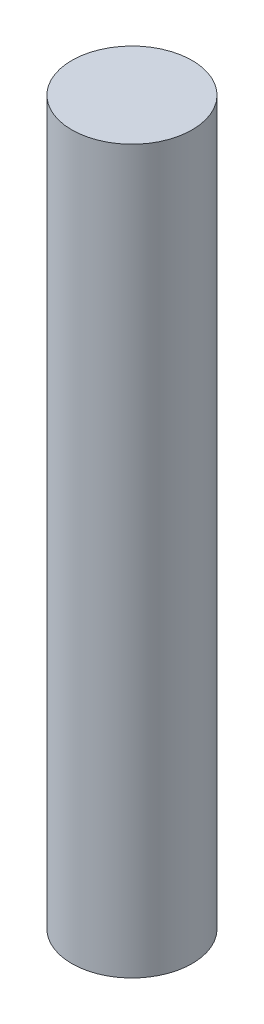
from build123d import *

# Parameters (mm, degrees)
SKETCH1_R           = 2.5
BOSS_EXTRUDE1_DEPTH = 30


with BuildPart() as part:
    # Sketch1 → Boss-Extrude1 (new body)
    with BuildSketch(Plane(origin=(0, 0, 0), x_dir=(1, 0, 0), z_dir=(0, 1, 0))):
        with Locations(Location((-2.447915396, -0.958023949, 0), (0, 0, 270))):
            Circle(SKETCH1_R)
    extrude(amount=-BOSS_EXTRUDE1_DEPTH)


solid = part.part
